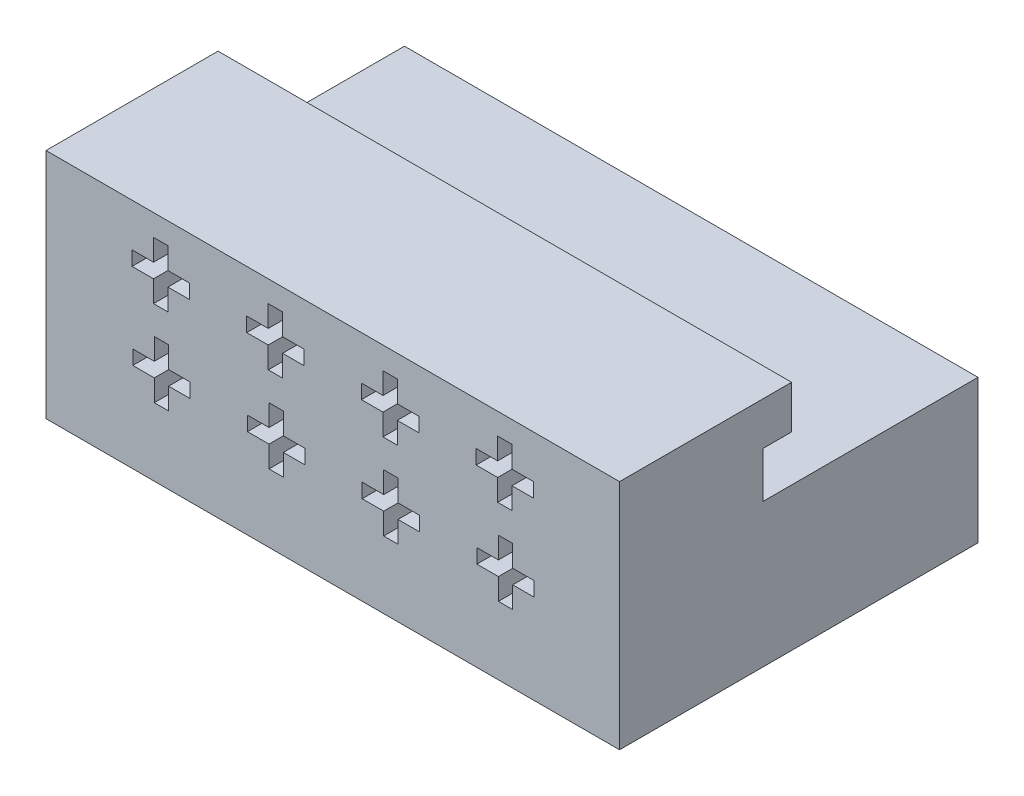
from build123d import *

# Parameters (mm, degrees)
BOSS_EXTRUDE1_DEPTH = 40
CUT_EXTRUDE3_DEPTH  = 8


with BuildPart() as part:
    # Sketch1 → Boss-Extrude1 (new body)
    with BuildSketch(Plane(origin=(0, 0, 0), x_dir=(0, 0, -1), z_dir=(1, 0, 0))):
        Polygon((-9.638596491, 6.2), (2.361403509, 6.2), (2.361403509, 3.2), (0.361403509, 3.2), (0.361403509, 0), (15.361403509, 0), (15.361403509, -10), (-9.638596491, -10), align=None)
    extrude(amount=BOSS_EXTRUDE1_DEPTH)

    # Sketch2 → Cut-Extrude3 (cut)
    with BuildSketch(Plane.XY.offset(9.638596491)):
        Polygon((14, 2.2), (14, 3.2), (15.5, 3.2), (15.5, 4.7), (16.5, 4.7), (16.5, 3.2), (18, 3.2), (18, 2.2), (16.5, 2.2), (16.5, 0.7), (15.5, 0.7), (15.5, 2.2), align=None)
        Polygon((14.051371054, -3.758215043), (14.051371054, -2.758215043), (15.551371054, -2.758215043), (15.551371054, -1.258215043), (16.551371054, -1.258215043), (16.551371054, -2.758215043), (18.051371054, -2.758215043), (18.051371054, -3.758215043), (16.551371054, -3.758215043), (16.551371054, -5.258215043), (15.551371054, -5.258215043), (15.551371054, -3.758215043), align=None)
        Polygon((22.051371054, -3.808568011), (22.051371054, -2.808568011), (23.551371054, -2.808568011), (23.551371054, -1.308568011), (24.551371054, -1.308568011), (24.551371054, -2.808568011), (26.051371054, -2.808568011), (26.051371054, -3.808568011), (24.551371054, -3.808568011), (24.551371054, -5.308568011), (23.551371054, -5.308568011), (23.551371054, -3.808568011), align=None)
        Polygon((22, 2.149647032), (22, 3.149647032), (23.5, 3.149647032), (23.5, 4.649647032), (24.5, 4.649647032), (24.5, 3.149647032), (26, 3.149647032), (26, 2.149647032), (24.5, 2.149647032), (24.5, 0.649647032), (23.5, 0.649647032), (23.5, 2.149647032), align=None)
        Polygon((30, 2.2), (30, 3.2), (31.5, 3.2), (31.5, 4.7), (32.5, 4.7), (32.5, 3.2), (34, 3.2), (34, 2.2), (32.5, 2.2), (32.5, 0.7), (31.5, 0.7), (31.5, 2.2), align=None)
        Polygon((30.051371054, -3.758215043), (30.051371054, -2.758215043), (31.551371054, -2.758215043), (31.551371054, -1.258215043), (32.551371054, -1.258215043), (32.551371054, -2.758215043), (34.051371054, -2.758215043), (34.051371054, -3.758215043), (32.551371054, -3.758215043), (32.551371054, -5.258215043), (31.551371054, -5.258215043), (31.551371054, -3.758215043), align=None)
        Polygon((6, 2.2), (6, 3.2), (7.5, 3.2), (7.5, 4.7), (8.5, 4.7), (8.5, 3.2), (10, 3.2), (10, 2.2), (8.5, 2.2), (8.5, 0.7), (7.5, 0.7), (7.5, 2.2), align=None)
        Polygon((6.051371054, -2.758215043), (7.551371054, -2.758215043), (7.551371054, -1.258215043), (8.551371054, -1.258215043), (8.551371054, -2.758215043), (10.051371054, -2.758215043), (10.051371054, -3.758215043), (8.551371054, -3.758215043), (8.551371054, -5.258215043), (7.551371054, -5.258215043), (7.551371054, -3.758215043), (6.051371054, -3.758215043), align=None)
    extrude(amount=-CUT_EXTRUDE3_DEPTH, mode=Mode.SUBTRACT)


solid = part.part
